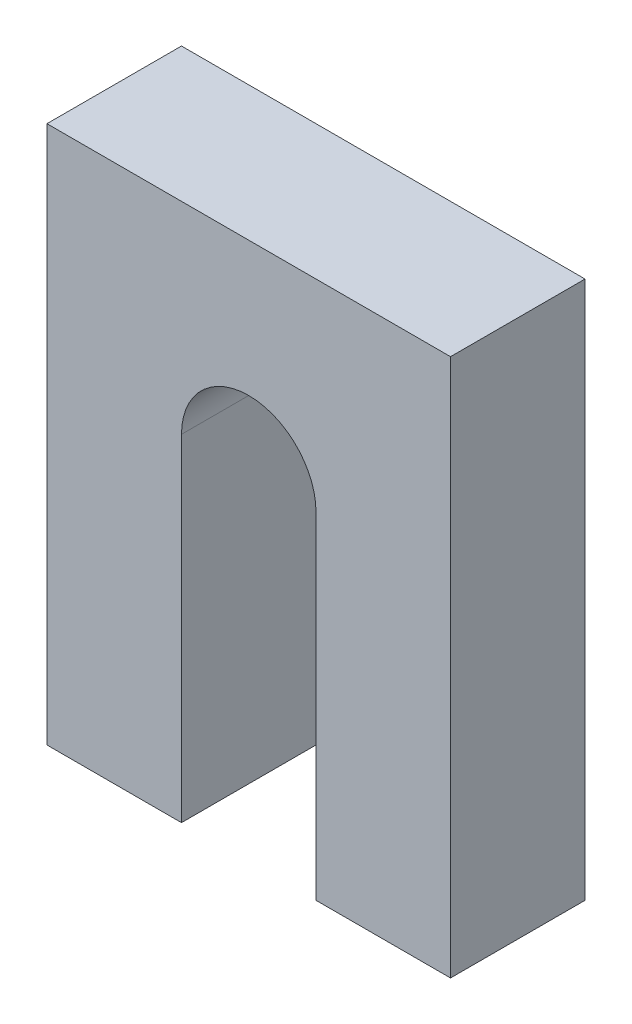
from build123d import *

# Parameters (mm, degrees)
BOSS_EXTRUDE1_DEPTH = 10


with BuildPart() as part:
    # Sketch1 → Boss-Extrude1 (new body)
    with BuildSketch(Plane.XY):
        with BuildLine():
            Line((-5, 0), (-5, -25))
            Line((-5, -25), (-15, -25))
            Line((-15, -25), (-15, 15))
            Line((-15, 15), (15, 15))
            Line((15, 15), (15, -25))
            Line((15, -25), (5, -25))
            Line((5, -25), (5, 0))
            ThreePointArc((5, 0), (0, 5), (-5, 0))
        make_face()
    extrude(amount=BOSS_EXTRUDE1_DEPTH)


solid = part.part
